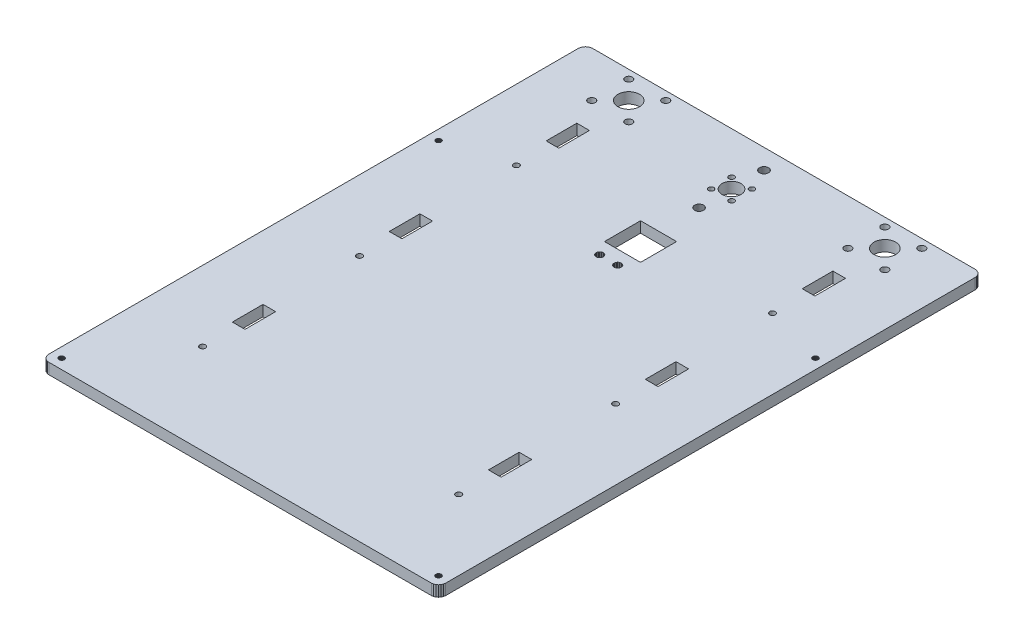
from build123d import *

# Parameters (mm, degrees)
CROQUIS1_R              = 5.25
CROQUIS1_R_2            = 1.5
CROQUIS1_R_3            = 2
CROQUIS1_R_4            = 6
CROQUIS1_R_5            = 1.6
CROQUIS1_W              = 7
CROQUIS1_H              = 17
SALIENTE_EXTRUIR1_DEPTH = 6


with BuildPart() as part:
    # Croquis1 → Saliente-Extruir1 (new body)
    with BuildSketch(Plane(origin=(0, 0, 0), x_dir=(1, 0, 0), z_dir=(0, 1, 0))):
        Polygon((-106, -150.736137545), (106, -150.736137545), (107.03527618, -150.59984085), (108, -150.20023916), (108.828427125, -149.56456467), (109.464101615, -148.736137545), (109.863703305, -147.771413726), (110, -146.736137545), (110, 146.736137545), (109.863703305, 147.771413726), (109.464101615, 148.736137545), (108.828427125, 149.56456467), (108, 150.20023916), (107.03527618, 150.59984085), (106, 150.736137545), (-106, 150.736137545), (-107.03527618, 150.59984085), (-108, 150.20023916), (-108.828427125, 149.56456467), (-109.464101615, 148.736137545), (-109.863703305, 147.771413726), (-110, 146.736137545), (-110, -146.736137545), (-109.863703305, -147.771413726), (-109.464101615, -148.736137545), (-108.828427125, -149.56456467), (-108, -150.20023916), (-107.03527618, -150.59984085), align=None)
        with Locations(Location((0, 121.736137545, 0), (0, 0, 270))):
            Circle(CROQUIS1_R, mode=Mode.SUBTRACT)
        with Locations(Location((5.656854045, 127.392991795, 0), (0, 0, 270))):
            Circle(CROQUIS1_R_2, mode=Mode.SUBTRACT)
        with Locations(Location((-5.656854454, 127.392991795, 0), (0, 0, 270))):
            Circle(CROQUIS1_R_2, mode=Mode.SUBTRACT)
        with Locations(Location((-5.656854454, 116.079283296, 0), (0, 0, 270))):
            Circle(CROQUIS1_R_2, mode=Mode.SUBTRACT)
        with Locations(Location((5.656854045, 116.079283296, 0), (0, 0, 270))):
            Circle(CROQUIS1_R_2, mode=Mode.SUBTRACT)
        with Locations(Location((-81.253048327, 145.989185872, 0), (0, 0, 270))):
            Circle(CROQUIS1_R_3, mode=Mode.SUBTRACT)
        with Locations(Location((-60.746951673, 145.989185872, 0), (0, 0, 270))):
            Circle(CROQUIS1_R_3, mode=Mode.SUBTRACT)
        with Locations(Location((-81.253048327, 125.483089218, 0), (0, 0, 270))):
            Circle(CROQUIS1_R_3, mode=Mode.SUBTRACT)
        with Locations(Location((-60.746951673, 125.483089218, 0), (0, 0, 270))):
            Circle(CROQUIS1_R_3, mode=Mode.SUBTRACT)
        with Locations(Location((-71, 135.736137545, 0), (0, 0, 270))):
            Circle(CROQUIS1_R_4, mode=Mode.SUBTRACT)
        with Locations(Location((60.746951673, 145.989185872, 0), (0, 0, 270))):
            Circle(CROQUIS1_R_3, mode=Mode.SUBTRACT)
        with Locations(Location((81.253048327, 145.989185872, 0), (0, 0, 270))):
            Circle(CROQUIS1_R_3, mode=Mode.SUBTRACT)
        with Locations(Location((60.746951673, 125.483089218, 0), (0, 0, 270))):
            Circle(CROQUIS1_R_3, mode=Mode.SUBTRACT)
        with Locations(Location((81.253048327, 125.483089218, 0), (0, 0, 270))):
            Circle(CROQUIS1_R_3, mode=Mode.SUBTRACT)
        with Locations(Location((71, 135.736137545, 0), (0, 0, 270))):
            Circle(CROQUIS1_R_4, mode=Mode.SUBTRACT)
        with Locations(Location((-71, 73.440927881, 0), (0, 0, 270))):
            Circle(CROQUIS1_R_5, mode=Mode.SUBTRACT)
        with Locations(Location((-71, -13.559072119, 0), (0, 0, 270))):
            Circle(CROQUIS1_R_5, mode=Mode.SUBTRACT)
        with Locations(Location((-71, -100.559072119, 0), (0, 0, 270))):
            Circle(CROQUIS1_R_5, mode=Mode.SUBTRACT)
        with Locations(Location((71, -100.559072119, 0), (0, 0, 270))):
            Circle(CROQUIS1_R_5, mode=Mode.SUBTRACT)
        with Locations(Location((71, -13.559072119, 0), (0, 0, 270))):
            Circle(CROQUIS1_R_5, mode=Mode.SUBTRACT)
        with Locations(Location((71, 73.440927881, 0), (0, 0, 270))):
            Circle(CROQUIS1_R_5, mode=Mode.SUBTRACT)
        Polygon((-2.478612358, 139.409822065), (-2.500000205, 139.736137545), (-2.478612358, 140.062453026), (-2.414814771, 140.383185158), (-2.309699036, 140.692846126), (-2.165063714, 140.986137545), (-1.983383556, 141.258041118), (-1.767767158, 141.503904498), (-1.521903777, 141.719520896), (-1.250000205, 141.901201055), (-0.956708786, 142.045836376), (-0.647047818, 142.150952111), (-0.326315685, 142.214749699), (-2.05e-07, 142.236137545), (0.326315276, 142.214749699), (0.647047408, 142.150952111), (0.956708376, 142.045836376), (1.249999795, 141.901201055), (1.521903368, 141.719520896), (1.767766748, 141.503904498), (1.983383146, 141.258041118), (2.165063305, 140.986137545), (2.309698626, 140.692846126), (2.414814361, 140.383185158), (2.478611949, 140.062453026), (2.499999795, 139.736137545), (2.478611949, 139.409822065), (2.414814361, 139.089089932), (2.309698626, 138.779428964), (2.165063305, 138.486137545), (1.983383146, 138.214233973), (1.767766748, 137.968370592), (1.521903368, 137.752754194), (1.249999795, 137.571074036), (0.956708376, 137.426438714), (0.647047408, 137.321322979), (0.326315276, 137.257525392), (-2.05e-07, 137.236137545), (-0.326315685, 137.257525392), (-0.647047818, 137.321322979), (-0.956708786, 137.426438714), (-1.250000205, 137.571074036), (-1.521903777, 137.752754194), (-1.767767158, 137.968370592), (-1.983383556, 138.214233973), (-2.165063714, 138.486137545), (-2.309699036, 138.779428964), (-2.414814771, 139.089089932), align=None, mode=Mode.SUBTRACT)
        Polygon((-2.414814771, 103.089089932), (-2.478612358, 103.409822065), (-2.500000205, 103.736137545), (-2.478612358, 104.062453026), (-2.414814771, 104.383185158), (-2.309699036, 104.692846126), (-2.165063714, 104.986137545), (-1.983383556, 105.258041118), (-1.767767158, 105.503904498), (-1.521903777, 105.719520896), (-1.250000205, 105.901201055), (-0.956708786, 106.045836376), (-0.647047818, 106.150952111), (-0.326315685, 106.214749699), (-2.05e-07, 106.236137545), (0.326315276, 106.214749699), (0.647047408, 106.150952111), (0.956708376, 106.045836376), (1.249999795, 105.901201055), (1.521903368, 105.719520896), (1.767766748, 105.503904498), (1.983383146, 105.258041118), (2.165063305, 104.986137545), (2.309698626, 104.692846126), (2.414814361, 104.383185158), (2.478611949, 104.062453026), (2.499999795, 103.736137545), (2.478611949, 103.409822065), (2.414814361, 103.089089932), (2.309698626, 102.779428964), (2.165063305, 102.486137545), (1.983383146, 102.214233973), (1.767766748, 101.968370592), (1.521903368, 101.752754194), (1.249999795, 101.571074036), (0.956708376, 101.426438714), (0.647047408, 101.321322979), (0.326315276, 101.257525392), (-2.05e-07, 101.236137545), (-0.326315685, 101.257525392), (-0.647047818, 101.321322979), (-0.956708786, 101.426438714), (-1.250000205, 101.571074036), (-1.521903777, 101.752754194), (-1.767767158, 101.968370592), (-1.983383556, 102.214233973), (-2.165063714, 102.486137545), (-2.309699036, 102.779428964), align=None, mode=Mode.SUBTRACT)
        Polygon((-9, 81.263862455), (9, 81.263862455), (10, 81.263862455), (10, 80.263862455), (10, 62.263862455), (10, 61.263862455), (9, 61.263862455), (-9, 61.263862455), (-10, 61.263862455), (-10, 62.263862455), (-10, 80.263862455), (-10, 81.263862455), align=None, mode=Mode.SUBTRACT)
        Polygon((3.068148296, 53.089293137), (2.999999949, 53.606931227), (3.068148296, 54.124569318), (3.267949141, 54.606931227), (3.585786386, 55.02114479), (3.999999949, 55.338982035), (4.482361859, 55.53878288), (4.999999949, 55.606931227), (5.517638039, 55.53878288), (5.999999949, 55.338982035), (6.414213511, 55.02114479), (6.732050756, 54.606931227), (6.931851601, 54.124569318), (6.999999949, 53.606931227), (6.931851601, 53.089293137), (6.732050756, 52.606931227), (6.414213511, 52.192717665), (5.999999949, 51.87488042), (5.517638039, 51.675079575), (4.999999949, 51.606931227), (4.482361859, 51.675079575), (3.999999949, 51.87488042), (3.585786386, 52.192717665), (3.267949141, 52.606931227), align=None, mode=Mode.SUBTRACT)
        Polygon((-105.948888739, -145.624366113), (-106, -145.236137545), (-105.948888739, -144.847908978), (-105.799038106, -144.486137545), (-105.560660172, -144.175477373), (-105.25, -143.93709944), (-104.888228568, -143.787248806), (-104.5, -143.736137545), (-104.111771432, -143.787248806), (-103.75, -143.93709944), (-103.439339828, -144.175477373), (-103.200961894, -144.486137545), (-103.051111261, -144.847908978), (-103, -145.236137545), (-103.051111261, -145.624366113), (-103.200961894, -145.986137545), (-103.439339828, -146.296797717), (-103.75, -146.535175651), (-104.111771432, -146.685026285), (-104.5, -146.736137545), (-104.888228568, -146.685026285), (-105.25, -146.535175651), (-105.560660172, -146.296797717), (-105.799038106, -145.986137545), align=None, mode=Mode.SUBTRACT)
        with Locations((-71, 14.940927881)):
            Rectangle(CROQUIS1_W, CROQUIS1_H, mode=Mode.SUBTRACT)
        with Locations((-71, 101.940927881)):
            Rectangle(CROQUIS1_W, CROQUIS1_H, mode=Mode.SUBTRACT)
        with Locations((-71, -72.059072119)):
            Rectangle(CROQUIS1_W, CROQUIS1_H, mode=Mode.SUBTRACT)
        with Locations((71, -72.059072119)):
            Rectangle(CROQUIS1_W, CROQUIS1_H, mode=Mode.SUBTRACT)
        with Locations((71, 14.940927881)):
            Rectangle(CROQUIS1_W, CROQUIS1_H, mode=Mode.SUBTRACT)
        with Locations((71, 101.940927881)):
            Rectangle(CROQUIS1_W, CROQUIS1_H, mode=Mode.SUBTRACT)
        Polygon((103.200961894, -145.986137545), (103.051111261, -145.624366113), (103, -145.236137545), (103.051111261, -144.847908978), (103.200961894, -144.486137545), (103.439339828, -144.175477373), (103.75, -143.93709944), (104.111771432, -143.787248806), (104.5, -143.736137545), (104.888228568, -143.787248806), (105.25, -143.93709944), (105.560660172, -144.175477373), (105.799038106, -144.486137545), (105.948888739, -144.847908978), (106, -145.236137545), (105.948888739, -145.624366113), (105.799038106, -145.986137545), (105.560660172, -146.296797717), (105.25, -146.535175651), (104.888228568, -146.685026285), (104.5, -146.736137545), (104.111771432, -146.685026285), (103.75, -146.535175651), (103.439339828, -146.296797717), align=None, mode=Mode.SUBTRACT)
        Polygon((-106, 63.763862455), (-105.948888739, 64.152091022), (-105.799038106, 64.513862455), (-105.560660172, 64.824522627), (-105.25, 65.06290056), (-104.888228568, 65.212751194), (-104.5, 65.263862455), (-104.111771432, 65.212751194), (-103.75, 65.06290056), (-103.439339828, 64.824522627), (-103.200961894, 64.513862455), (-103.051111261, 64.152091022), (-103, 63.763862455), (-103.051111261, 63.375633887), (-103.200961894, 63.013862455), (-103.439339828, 62.703202283), (-103.75, 62.464824349), (-104.111771432, 62.314973715), (-104.5, 62.263862455), (-104.888228568, 62.314973715), (-105.25, 62.464824349), (-105.560660172, 62.703202283), (-105.799038106, 63.013862455), (-105.948888739, 63.375633887), align=None, mode=Mode.SUBTRACT)
        Polygon((103, 63.763862455), (103.051111261, 64.152091022), (103.200961894, 64.513862455), (103.439339828, 64.824522627), (103.75, 65.06290056), (104.111771432, 65.212751194), (104.5, 65.263862455), (104.888228568, 65.212751194), (105.25, 65.06290056), (105.560660172, 64.824522627), (105.799038106, 64.513862455), (105.948888739, 64.152091022), (106, 63.763862455), (105.948888739, 63.375633887), (105.799038106, 63.013862455), (105.560660172, 62.703202283), (105.25, 62.464824349), (104.888228568, 62.314973715), (104.5, 62.263862455), (104.111771432, 62.314973715), (103.75, 62.464824349), (103.439339828, 62.703202283), (103.200961894, 63.013862455), (103.051111261, 63.375633887), align=None, mode=Mode.SUBTRACT)
        Polygon((-7.000000051, 53.606931227), (-6.931851704, 54.124569318), (-6.732050859, 54.606931227), (-6.414213614, 55.02114479), (-6.000000051, 55.338982035), (-5.517638141, 55.53878288), (-5.000000051, 55.606931227), (-4.482361961, 55.53878288), (-4.000000051, 55.338982035), (-3.585786489, 55.02114479), (-3.267949244, 54.606931227), (-3.068148399, 54.124569318), (-3.000000051, 53.606931227), (-3.068148399, 53.089293137), (-3.267949244, 52.606931227), (-3.585786489, 52.192717665), (-4.000000051, 51.87488042), (-4.482361961, 51.675079575), (-5.000000051, 51.606931227), (-5.517638141, 51.675079575), (-6.000000051, 51.87488042), (-6.414213614, 52.192717665), (-6.732050859, 52.606931227), (-6.931851704, 53.089293137), align=None, mode=Mode.SUBTRACT)
    extrude(amount=SALIENTE_EXTRUIR1_DEPTH)


solid = part.part
